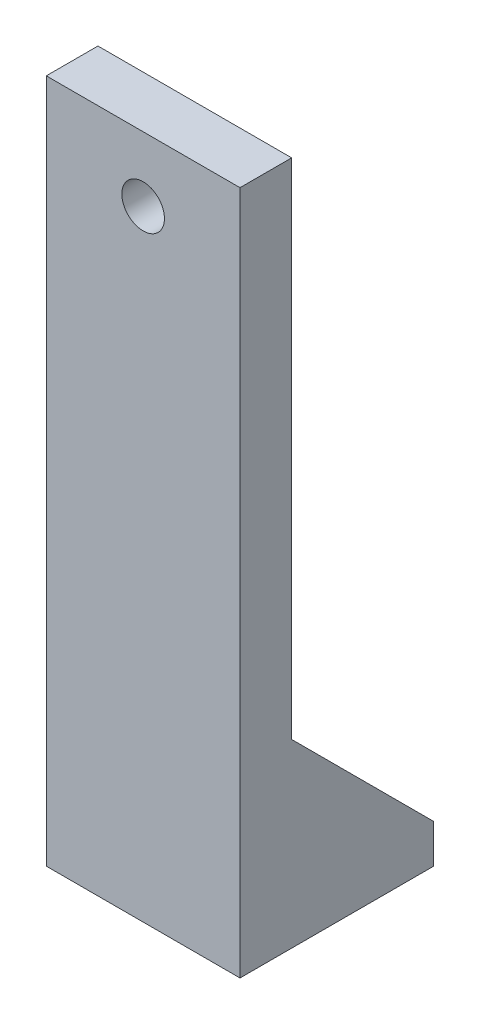
from build123d import *

# Parameters (mm, degrees)
SKETCH1_W           = 15
SKETCH1_H           = 15
SKETCH1_R           = 2.65
BOSS_EXTRUDE1_DEPTH = 3
SKETCH2_W           = 15
SKETCH2_H           = 4
BOSS_EXTRUDE2_DEPTH = 50
BOSS_EXTRUDE3_DEPTH = 3
SKETCH4_R           = 1.65
CUT_EXTRUDE1_DEPTH  = 13


with BuildPart() as part:
    # Sketch1 → Boss-Extrude1 (new body)
    with BuildSketch(Plane(origin=(0, 0, 0), x_dir=(1, 0, 0), z_dir=(0, 1, 0))):
        with Locations((7.5, 7.5)):
            Rectangle(SKETCH1_W, SKETCH1_H)
        with Locations(Location((7.5, 9, 0), (0, 0, 270))):
            Circle(SKETCH1_R, mode=Mode.SUBTRACT)
    extrude(amount=BOSS_EXTRUDE1_DEPTH)

    # Sketch2 → Boss-Extrude2 (add)
    with BuildSketch(Plane(origin=(0, 3, 0), x_dir=(1, 0, 0), z_dir=(0, 1, 0))):
        with Locations((7.5, 2)):
            Rectangle(SKETCH2_W, SKETCH2_H)
    extrude(amount=BOSS_EXTRUDE2_DEPTH)

    # Sketch3 → Boss-Extrude3 (add)
    with BuildSketch(Plane(origin=(15, 0, 0), x_dir=(0, 0, -1), z_dir=(1, 0, 0))):
        Polygon((4, 14), (15, 3), (4, 3), align=None)
    boss_extrude3 = extrude(amount=-BOSS_EXTRUDE3_DEPTH)

    # Mirror1: Boss-Extrude3 across plane
    add(boss_extrude3.mirror(Plane.ZY.offset(-7.5)))

    # Sketch4 → Cut-Extrude1 (cut)
    with BuildSketch(Plane(origin=(0, 0, -4), x_dir=(-1, 0, 0), z_dir=(0, 0, -1))):
        with Locations((-7.5, 48)):
            Circle(SKETCH4_R)
    extrude(amount=-CUT_EXTRUDE1_DEPTH, mode=Mode.SUBTRACT)


solid = part.part
